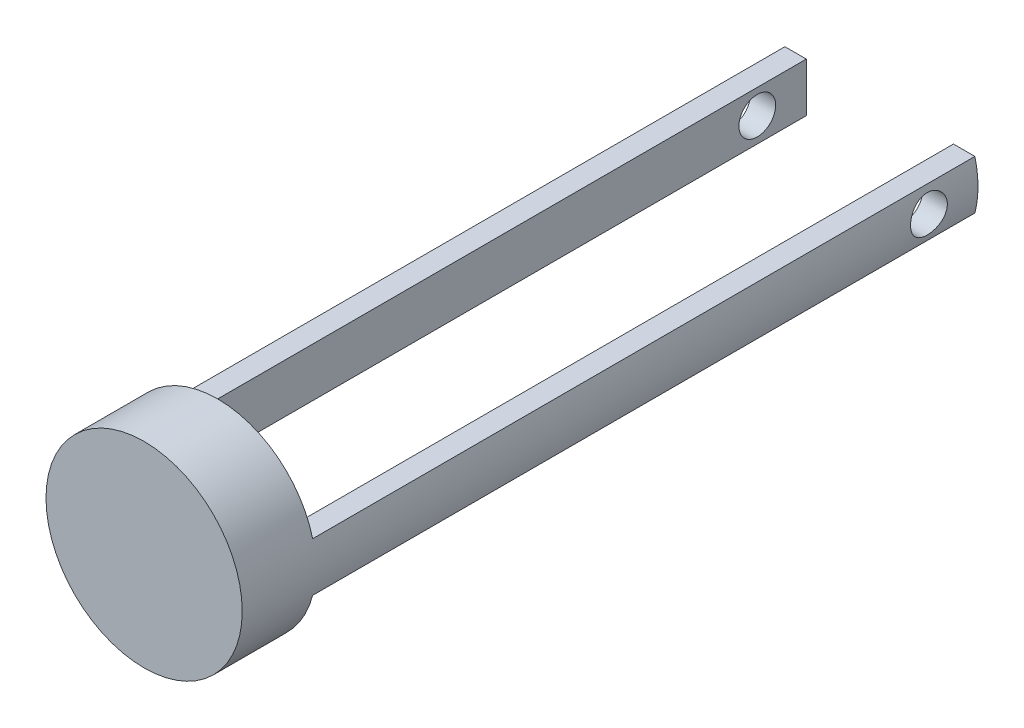
from build123d import *

# Parameters (mm, degrees)
BOSS_EXTRUDE1_DEPTH     = 38.1
BOSS_EXTRUDE2_DEPTH     = 381
CUT_EXTRUDE1_DEPTH      = 395.518504002
CUT_EXTRUDE1_DEPTH_BACK = 395.518504002
SKETCH2_R               = 9.525


with BuildPart() as part:
    # Sketch1 → Boss-Extrude1 (new body)
    with BuildSketch(Plane.XY):
        with BuildLine():
            Line((38.1, 12.7), (49.186888497, 12.7))
            ThreePointArc((49.186888497, 12.7), (0, 50.8), (-49.186888497, 12.7))
            Line((-49.186888497, 12.7), (-38.1, 12.7))
            Line((-38.1, 12.7), (-38.1, -12.7))
            Line((-38.1, -12.7), (-49.186888497, -12.7))
            ThreePointArc((-49.186888497, -12.7), (0, -50.8), (49.186888497, -12.7))
            Line((49.186888497, -12.7), (38.1, -12.7))
            Line((38.1, -12.7), (38.1, 12.7))
        make_face()
    extrude(amount=-BOSS_EXTRUDE1_DEPTH)

    # Sketch1<3> → Boss-Extrude2 (add)
    with BuildSketch(Plane.XY):
        with BuildLine():
            ThreePointArc((49.186888497, -12.7), (50.8, 0), (49.186888497, 12.7))
            Line((49.186888497, 12.7), (38.1, 12.7))
            Line((38.1, 12.7), (38.1, -12.7))
            Line((38.1, -12.7), (49.186888497, -12.7))
        make_face()
        with BuildLine():
            Line((-38.1, 12.7), (-49.186888497, 12.7))
            ThreePointArc((-49.186888497, 12.7), (-50.8, 0), (-49.186888497, -12.7))
            Line((-49.186888497, -12.7), (-38.1, -12.7))
            Line((-38.1, -12.7), (-38.1, 12.7))
        make_face()
    extrude(amount=-BOSS_EXTRUDE2_DEPTH)

    # Sketch2 → Cut-Extrude1 (cut, two sides: drawn at the far end of the back side and taken through both)
    with BuildSketch(Plane(origin=(-38.1, 0, 0), x_dir=(0, 0, -1), z_dir=(1, 0, 0)).offset(-CUT_EXTRUDE1_DEPTH_BACK)):
        with Locations((355.6, 0)):
            Circle(SKETCH2_R)
    extrude(amount=CUT_EXTRUDE1_DEPTH + CUT_EXTRUDE1_DEPTH_BACK, mode=Mode.SUBTRACT)


solid = part.part
